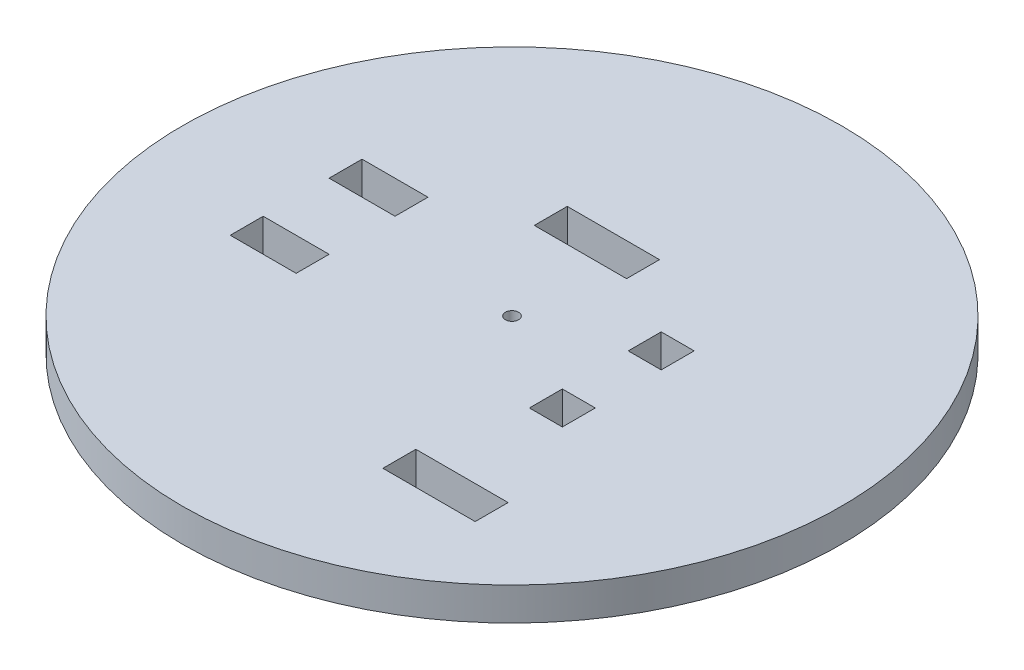
from build123d import *

# Parameters (mm, degrees)
SKETCH1_R           = 63.5
SKETCH1_W           = 17.78
SKETCH1_H           = 6.35
SKETCH1_W_2         = 6.35
SKETCH1_R_2         = 1.27
BOSS_EXTRUDE3_DEPTH = 6.35


with BuildPart() as part:
    # Sketch1 → Boss-Extrude3 (new body)
    with BuildSketch(Plane(origin=(0, 0, 0), x_dir=(1, 0, 0), z_dir=(0, 1, 0))):
        with Locations(Location((0, 0, 0), (0, 0, 270))):
            Circle(SKETCH1_R)
        Polygon((-34.262799333, -7.326577006), (-27.912799333, -7.326577006), (-27.912799333, -13.676577006), (-34.262799333, -13.676577006), (-40.612799333, -13.676577006), (-40.612799333, -7.326577006), align=None, mode=Mode.SUBTRACT)
        with Locations((21.870627403, -34.682199949)):
            Rectangle(SKETCH1_W, SKETCH1_H, mode=Mode.SUBTRACT)
        with Locations((20.20048917, -10.501577006)):
            Rectangle(SKETCH1_W_2, SKETCH1_H, mode=Mode.SUBTRACT)
        Polygon((-27.912799333, 5.373422994), (-34.262799333, 5.373422994), (-40.612799333, 5.373422994), (-40.612799333, 11.723422994), (-34.262799333, 11.723422994), (-27.912799333, 11.723422994), align=None, mode=Mode.SUBTRACT)
        with Locations((-4.076334422, 20.437374514)):
            Rectangle(SKETCH1_W, SKETCH1_H, mode=Mode.SUBTRACT)
        with Locations(Location((0, 0, 0), (0, 0, 270))):
            Circle(SKETCH1_R_2, mode=Mode.SUBTRACT)
        with Locations((20.20048917, 8.548422994)):
            Rectangle(SKETCH1_W_2, SKETCH1_H, mode=Mode.SUBTRACT)
    extrude(amount=BOSS_EXTRUDE3_DEPTH)


solid = part.part
